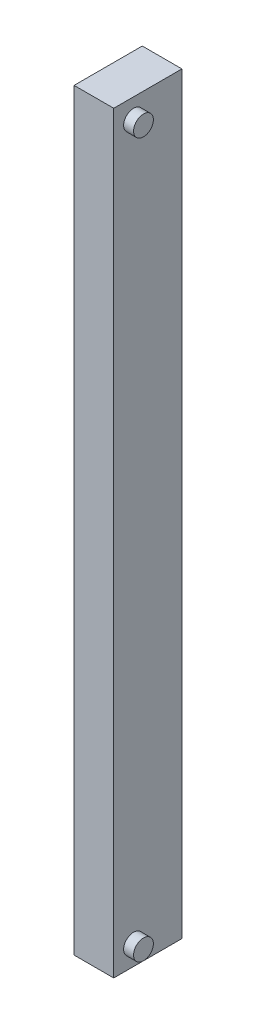
from build123d import *

# Parameters (mm, degrees)
SKETCH1_W           = 25.4
SKETCH1_H           = 25.4
BOSS_EXTRUDE1_DEPTH = 482.6
SKETCH2_R           = 6.35
BOSS_EXTRUDE2_DEPTH = 6.35
SKETCH3_R           = 6.35
BOSS_EXTRUDE3_DEPTH = 6.35
SKETCH4_W           = 25.4
SKETCH4_H           = 482.6
BOSS_EXTRUDE4_DEPTH = 18.288


with BuildPart() as part:
    # Sketch1 → Boss-Extrude1 (new body)
    with BuildSketch(Plane(origin=(0, 0, 0), x_dir=(1, 0, 0), z_dir=(0, 1, 0))):
        with Locations((12.7, 12.7)):
            Rectangle(SKETCH1_W, SKETCH1_H)
    extrude(amount=BOSS_EXTRUDE1_DEPTH)

    # Sketch2 → Boss-Extrude2 (add)
    with BuildSketch(Plane(origin=(25.4, 0, 0), x_dir=(0, 0, -1), z_dir=(1, 0, 0))):
        with Locations(Location((12.7, 469.9, 0), (0, 0, 180))):
            Circle(SKETCH2_R)
    extrude(amount=BOSS_EXTRUDE2_DEPTH)

    # Sketch3 → Boss-Extrude3 (add)
    with BuildSketch(Plane(origin=(25.4, 0, 0), x_dir=(0, 0, -1), z_dir=(1, 0, 0))):
        with Locations(Location((12.7, 12.7, 0), (0, 0, 180))):
            Circle(SKETCH3_R)
    extrude(amount=BOSS_EXTRUDE3_DEPTH)

    # Sketch4 → Boss-Extrude4 (add)
    with BuildSketch(Plane(origin=(0, 0, -25.4), x_dir=(-1, 0, 0), z_dir=(0, 0, -1))):
        with Locations((-12.7, 241.3)):
            Rectangle(SKETCH4_W, SKETCH4_H)
    extrude(amount=BOSS_EXTRUDE4_DEPTH)


solid = part.part
